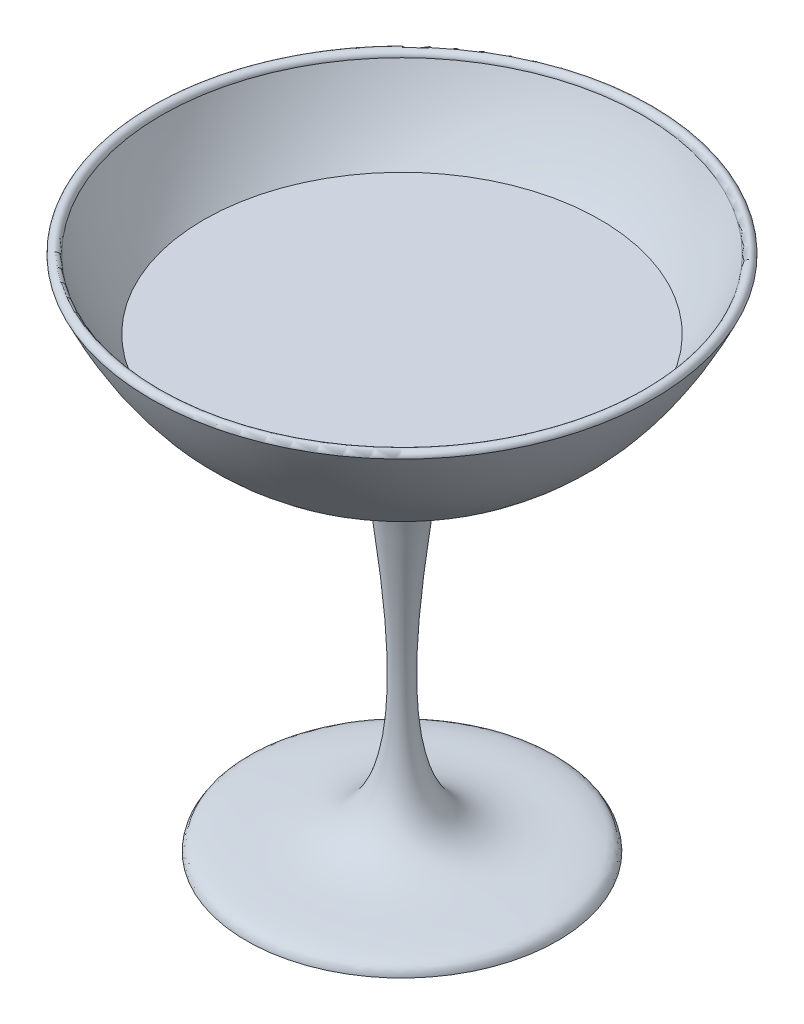
from build123d import *


with BuildPart() as part:
    # Sketch1 → Revolve1 (revolve)
    with BuildSketch(Plane.XY, mode=Mode.PRIVATE) as revolve1_sk:
        with BuildLine():
            Line((0, 0), (28.679995273, 0))
            add(Edge.make_bspline(
                [(28.679995273, 0), (28.499550341, 1.474416408), (23.447795777, 2.915897209), (14.909867742, 2.165032734), (0.889007044, 8.959781172), (1.268629115, 31.636291975), (4.867826269, 61.855169993), (5.62571258, 63.456043511), (23.942811369, 69.32451964), (37.523066981, 76.491333322), (46.316656487, 95.369942809)],
                knots=[0, 0, 0, 0, 0.03919043, 0.186235894, 0.242972378, 0.549818786, 0.611419908, 0.797382476, 0.838565018, 1, 1, 1, 1], degree=3))
            ThreePointArc((46.316656487, 95.369942809), (45.348200734, 96.338398562), (44.379744981, 95.369942809))
            add(Edge.make_bspline(
                [(0, 65.079110379), (18.358533332, 68.581128732), (35.137731713, 73.623769404), (44.379744981, 95.369942809)],
                knots=[0, 0, 0, 0, 1, 1, 1, 1], degree=3))
            Line((0, 65.079110379), (0, 0))
        make_face()
    revolve(revolve1_sk.sketch.rotate(Axis((0, 0, 0), (0, 1, 0)), 90), axis=Axis((0, 0, 0), (0, 1, 0)))


with BuildPart() as body_2:
    # Sketch2 → Revolve2 (revolve)
    with BuildSketch(Plane.XY):
        with BuildLine():
            Line((0, 82.600802979), (0, 65.406756668))
            add(Edge.make_bspline(
                [(0, 65.406756668), (13.97391783, 68.072379015), (27.036949285, 71.517250648), (36.555364428, 82.600802979)],
                knots=[0, 0, 0, 0, 0.761167441, 0.761167441, 0.761167441, 0.761167441], degree=3))
            Line((36.555364428, 82.600802979), (0, 82.600802979))
        make_face()
    revolve(axis=Axis((0, 82.600802979, 0), (0, -1, 0)))


solid = Compound([part.part, body_2.part])
